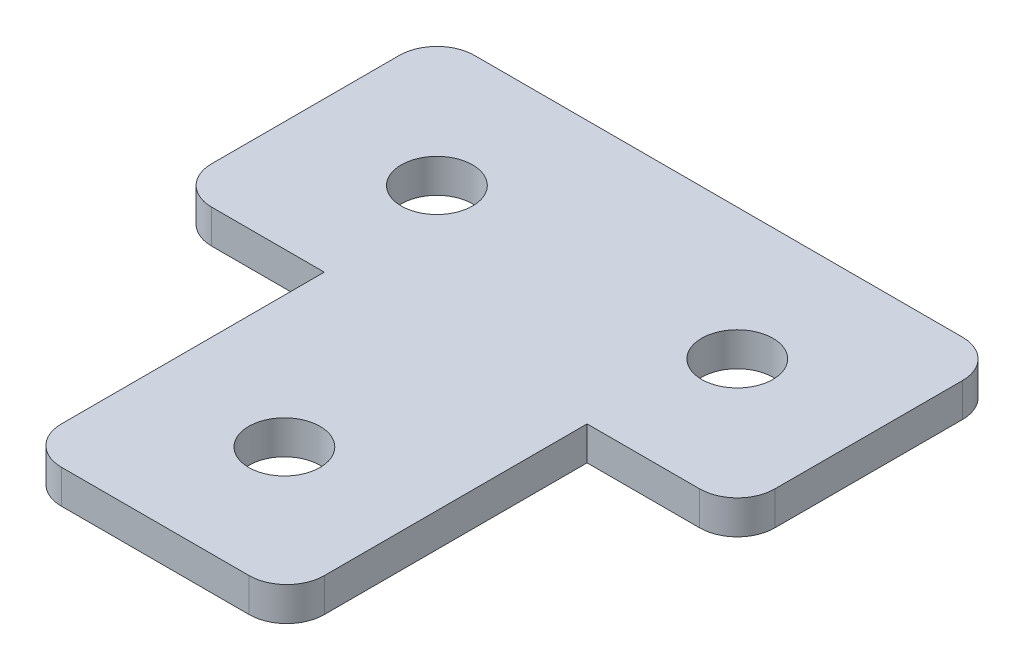
from build123d import *

# Parameters (mm, degrees)
SKETCH_1_R      = 1.9
EXTRUDE_1_DEPTH = 1.8
FILLET_1_R      = 2


with BuildPart() as part:
    # 草图1 → 凸台-拉伸1 (new body)
    with BuildSketch(Plane(origin=(0, 0, 0), x_dir=(1, 0, 0), z_dir=(0, 1, 0))):
        Polygon((0, -14), (8, -14), (8, -30), (22, -30), (22, -14), (30, -14), (30, 0), (0, 0), align=None)
        with Locations(Location((7, -7, 0), (0, 0, 270))):
            Circle(SKETCH_1_R, mode=Mode.SUBTRACT)
        with Locations(Location((23, -7, 0), (0, 0, 270))):
            Circle(SKETCH_1_R, mode=Mode.SUBTRACT)
        with Locations(Location((15, -23.124515497, 0), (0, 0, 270))):
            Circle(SKETCH_1_R, mode=Mode.SUBTRACT)
    extrude(amount=EXTRUDE_1_DEPTH)

    # 圆角1
    fillet_1_edges = [part.edges().sort_by_distance(p)[0] for p in [
        (0, 0.9, 0),
        (30, 0.9, 0),
        (30, 0.9, 14),
        (22, 0.9, 30),
        (8, 0.9, 30),
        (0, 0.9, 14),
    ]]
    fillet(fillet_1_edges, radius=FILLET_1_R)


solid = part.part
